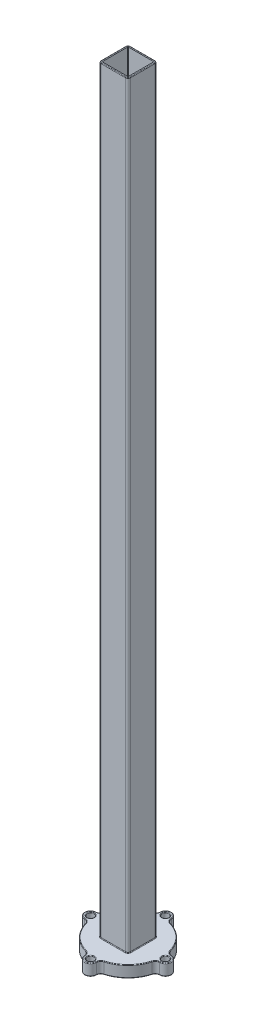
from build123d import *

# Parameters (mm, degrees)
BOSS_EXTRUDE1_DEPTH = 10
SKETCH5_R           = 3
CUT_EXTRUDE2_DEPTH  = 54.68966381
SKETCH2_R           = 27.55
CUT_EXTRUDE3_DEPTH  = 6.3
SKETCH8_W           = 25.2
SKETCH8_H           = 25.2
BOSS_EXTRUDE2_DEPTH = 658
SKETCH9_W           = 22.35
SKETCH9_H           = 22.35
CUT_EXTRUDE4_DEPTH  = 667.391078872
FILLET1_R           = 2
FILLET2_R           = 4
FILLET3_R           = 0.5
FILLET4_R           = 0.5


with BuildPart() as part:
    # Sketch1 → Boss-Extrude1 (new body)
    with BuildSketch(Plane(origin=(0, 0, 0), x_dir=(1, 0, 0), z_dir=(0, 1, 0))):
        with BuildLine():
            ThreePointArc((4.075627478, 29.403577956), (0, 37.3), (-4.075627478, 29.403577956))
            ThreePointArc((-4.075627478, 29.403577956), (-20.990249355, 20.990249355), (-29.403577956, 4.075627478))
            ThreePointArc((-29.403577956, 4.075627478), (-37.3, 0), (-29.403577956, -4.075627478))
            ThreePointArc((-29.403577956, -4.075627478), (-20.990249355, -20.990249355), (-4.075627478, -29.403577956))
            ThreePointArc((-4.075627478, -29.403577956), (0, -37.3), (4.075627478, -29.403577956))
            ThreePointArc((4.075627478, -29.403577956), (20.990249355, -20.990249355), (29.403577956, -4.075627478))
            ThreePointArc((29.403577956, -4.075627478), (37.3, 0), (29.403577956, 4.075627478))
            ThreePointArc((29.403577956, 4.075627478), (20.990249355, 20.990249355), (4.075627478, 29.403577956))
        make_face()
    extrude(amount=BOSS_EXTRUDE1_DEPTH)

    # Sketch5 → Cut-Extrude2 (cut, through all)
    with BuildSketch(Plane(origin=(0, 0, 0), x_dir=(-1, 0, 0), z_dir=(0, -1, 0))):
        with Locations(Location((32.3, 0, 0), (0, 0, 90))):
            Circle(SKETCH5_R)
        with Locations(Location((0, 32.3, 0), (0, 0, 90))):
            Circle(SKETCH5_R)
        with Locations(Location((-32.3, 0, 0), (0, 0, 90))):
            Circle(SKETCH5_R)
        with Locations(Location((0, -32.3, 0), (0, 0, 90))):
            Circle(SKETCH5_R)
    extrude(amount=-CUT_EXTRUDE2_DEPTH, mode=Mode.SUBTRACT)

    # Sketch2 → Cut-Extrude3 (cut)
    with BuildSketch(Plane.XZ):
        with Locations(Location((0, 0, 0), (0, 0, 270))):
            Circle(SKETCH2_R)
    extrude(amount=-CUT_EXTRUDE3_DEPTH, mode=Mode.SUBTRACT)

    # Sketch8 → Boss-Extrude2 (add)
    with BuildSketch(Plane.XZ.offset(-6.3)):
        Rectangle(SKETCH8_W, SKETCH8_H)
    extrude(amount=-BOSS_EXTRUDE2_DEPTH)

    # Sketch9 → Cut-Extrude4 (cut, through all)
    with BuildSketch(Plane(origin=(0, 664.3, 0), x_dir=(1, 0, 0), z_dir=(0, 1, 0))):
        Rectangle(SKETCH9_W, SKETCH9_H)
    extrude(amount=-CUT_EXTRUDE4_DEPTH, mode=Mode.SUBTRACT)

    # Fillet1
    fillet1_edges = [part.edges().sort_by_distance(p)[0] for p in [
        (-12.6, 337.15, -12.6),
        (-12.6, 337.15, 12.6),
        (12.6, 337.15, 12.6),
        (12.6, 337.15, -12.6),
    ]]
    fillet(fillet1_edges, radius=FILLET1_R)

    # Fillet2
    fillet2_edges = [part.edges().sort_by_distance(p)[0] for p in [
        (29.403577956, 5, -4.075627478),
        (29.403577956, 5, 4.075627478),
        (4.075627478, 5, 29.403577956),
        (-4.075627478, 5, 29.403577956),
        (-29.403577956, 5, 4.075627478),
        (-29.403577956, 5, -4.075627478),
        (-4.075627478, 5, -29.403577956),
        (4.075627478, 5, -29.403577956),
    ]]
    fillet(fillet2_edges, radius=FILLET2_R)

    # Fillet3
    fillet3_edges = [part.edges().sort_by_distance(p)[0] for p in [
        (-12.6, 10, 0),
        (0, 10, -12.6),
        (12.014213562, 10, 12.014213562),
        (-12.014213562, 10, 12.014213562),
        (12.014213562, 10, -12.014213562),
        (-12.014213562, 10, -12.014213562),
        (37.3, 0, 0),
        (37.3, 10, 0),
        (20.990249355, 0, 20.990249355),
        (20.990249355, 10, 20.990249355),
        (0, 0, 37.3),
        (0, 10, 37.3),
        (-20.990249355, 0, 20.990249355),
        (-20.990249355, 10, 20.990249355),
        (-37.3, 0, 0),
        (-37.3, 10, 0),
        (-20.990249355, 0, -20.990249355),
        (-20.990249355, 10, -20.990249355),
        (0, 0, -37.3),
        (0, 10, -37.3),
        (20.990249355, 0, -20.990249355),
        (20.990249355, 10, -20.990249355),
        (30.01087402, 0, 5.836401303),
        (30.01087402, 10, 5.836401303),
        (5.836401303, 0, 30.01087402),
        (5.836401303, 10, 30.01087402),
        (-30.01087402, 0, 5.836401303),
        (-30.01087402, 10, 5.836401303),
        (-5.836401303, 0, 30.01087402),
        (-5.836401303, 10, 30.01087402),
        (-30.01087402, 0, -5.836401303),
        (-30.01087402, 10, -5.836401303),
        (-5.836401303, 0, -30.01087402),
        (-5.836401303, 10, -30.01087402),
        (5.836401303, 0, -30.01087402),
        (5.836401303, 10, -30.01087402),
        (30.01087402, 0, -5.836401303),
        (30.01087402, 10, -5.836401303),
        (0, 10, 35.3),
        (0, 0, 35.3),
        (-32.3, 10, 3),
        (-32.3, 0, 3),
        (0, 10, -29.3),
        (0, 0, -29.3),
        (32.3, 10, 3),
        (32.3, 0, 3),
        (0, 0, 27.55),
        (12.6, 10, 0),
        (0, 10, 12.6),
    ]]
    fillet(fillet3_edges, radius=FILLET3_R)

    # Fillet4
    fillet4_edges = [part.edges().sort_by_distance(p)[0] for p in [
        (-11.175, 335.3, 11.175),
        (-11.175, 335.3, -11.175),
        (11.175, 335.3, -11.175),
        (11.175, 335.3, 11.175),
        (12.6, 664.3, 0),
        (0, 664.3, 12.6),
        (-12.6, 664.3, 0),
        (0, 664.3, -12.6),
        (-12.014213562, 664.3, -12.014213562),
        (12.014213562, 664.3, -12.014213562),
        (-12.014213562, 664.3, 12.014213562),
        (12.014213562, 664.3, 12.014213562),
    ]]
    fillet(fillet4_edges, radius=FILLET4_R)


solid = part.part
